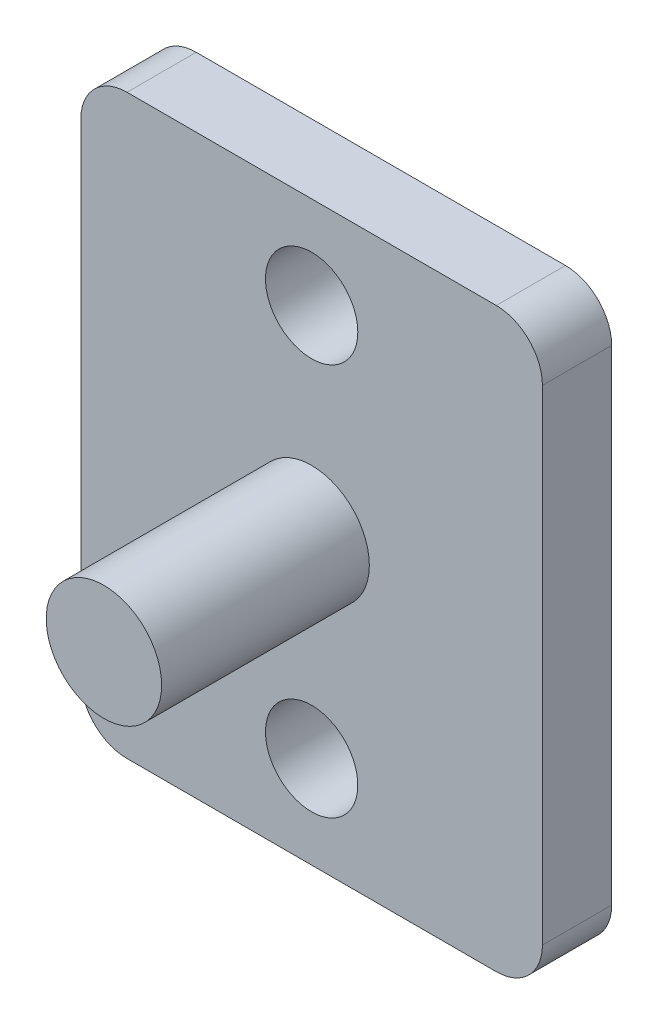
from build123d import *

# Parameters (mm, degrees)
ESQUISSE1_W        = 20
ESQUISSE1_H        = 25
ESQUISSE1_R        = 2
BOSS_EXTRU_1_DEPTH = 3
CONG_1_R           = 2
ESQUISSE2_R        = 2.5
BOSS_EXTRU_3_DEPTH = 9


with BuildPart() as part:
    # Esquisse1 → Boss.-Extru.1 (new body)
    with BuildSketch(Plane.XY):
        Rectangle(ESQUISSE1_W, ESQUISSE1_H)
        with Locations((0, 8.5)):
            Circle(ESQUISSE1_R, mode=Mode.SUBTRACT)
        with Locations(Location((0, -8.5, 0), (0, 0, 180))):
            Circle(ESQUISSE1_R, mode=Mode.SUBTRACT)
    extrude(amount=BOSS_EXTRU_1_DEPTH)

    # Congé1
    cong_1_edges = [part.edges().sort_by_distance(p)[0] for p in [
        (-10, 12.5, 1.5),
        (10, 12.5, 1.5),
        (10, -12.5, 1.5),
        (-10, -12.5, 1.5),
    ]]
    fillet(cong_1_edges, radius=CONG_1_R)

    # Esquisse2 → Boss.-Extru.3 (add)
    with BuildSketch(Plane.XY.offset(3)):
        Circle(ESQUISSE2_R)
    extrude(amount=BOSS_EXTRU_3_DEPTH)


solid = part.part
